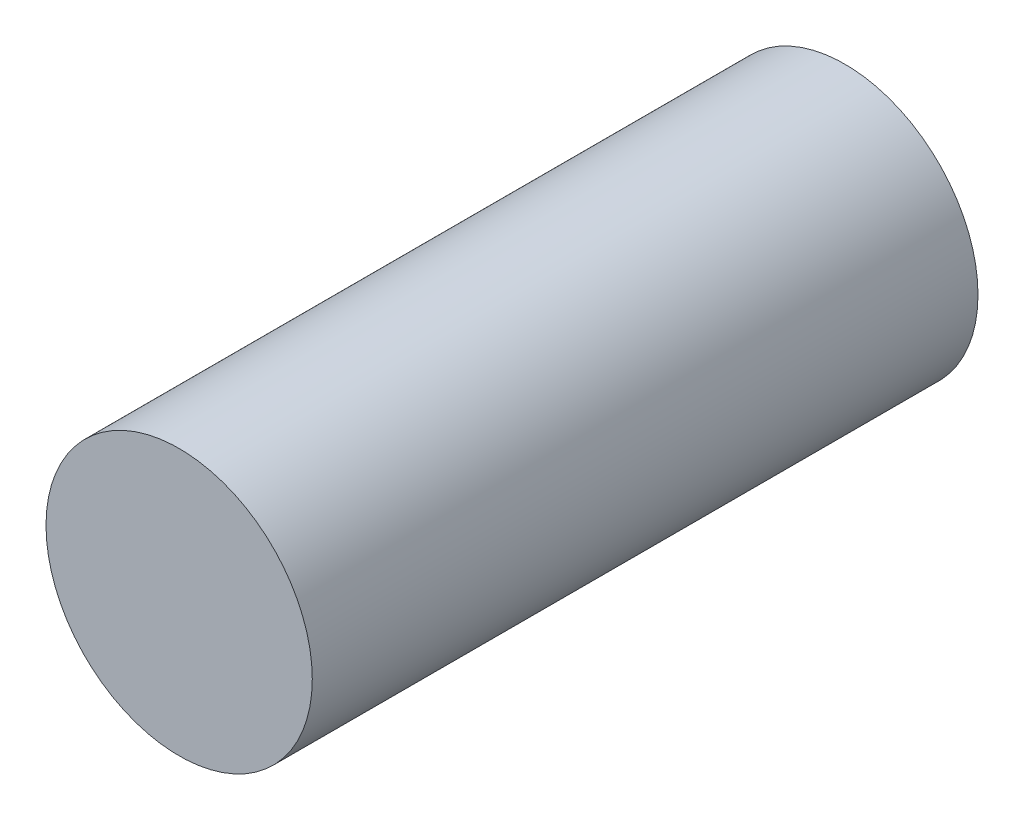
from build123d import *

# Parameters (mm, degrees)
SKETCH1_R           = 0.5
BOSS_EXTRUDE1_DEPTH = 2.5


with BuildPart() as part:
    # Sketch1 → Boss-Extrude1 (new body)
    with BuildSketch(Plane.XY):
        Circle(SKETCH1_R)
    extrude(amount=BOSS_EXTRUDE1_DEPTH)


solid = part.part
